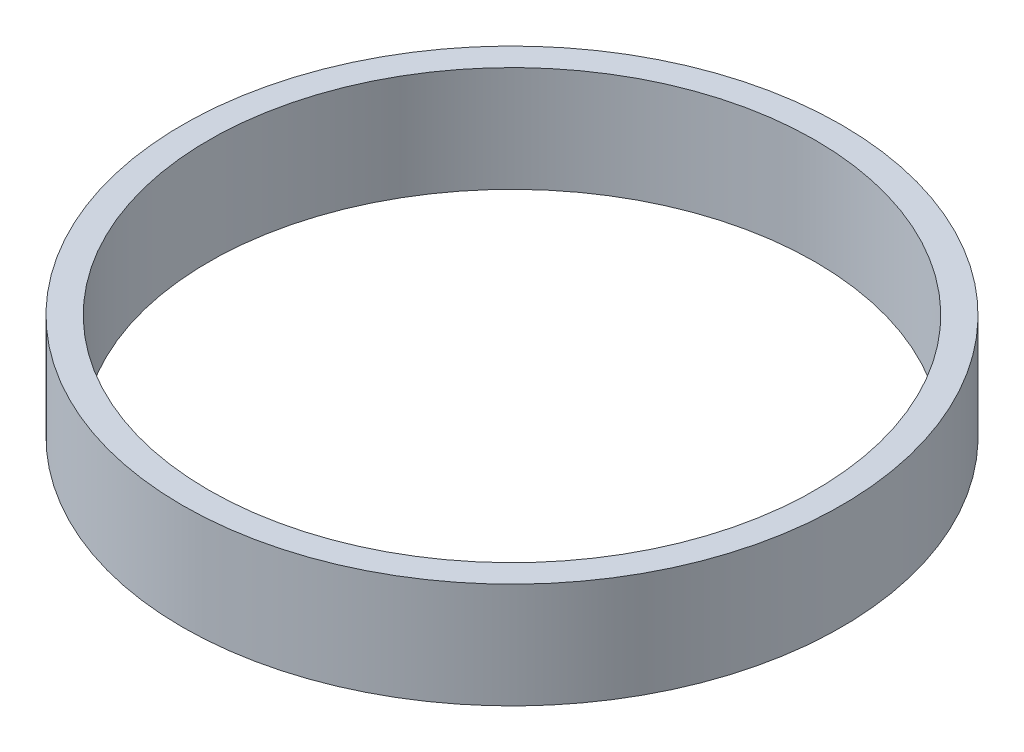
from build123d import *

# Parameters (mm, degrees)
SKETCH1_R           = 6.25
SKETCH1_R_2         = 5.75
BOSS_EXTRUDE1_DEPTH = 2


with BuildPart() as part:
    # Sketch1 → Boss-Extrude1 (new body)
    with BuildSketch(Plane(origin=(0, 0, 0), x_dir=(1, 0, 0), z_dir=(0, 1, 0))):
        with Locations(Location((0, 0, 0), (0, 0, 270))):
            Circle(SKETCH1_R)
        with Locations(Location((0, 0, 0), (0, 0, 270))):
            Circle(SKETCH1_R_2, mode=Mode.SUBTRACT)
    extrude(amount=BOSS_EXTRUDE1_DEPTH)


solid = part.part
